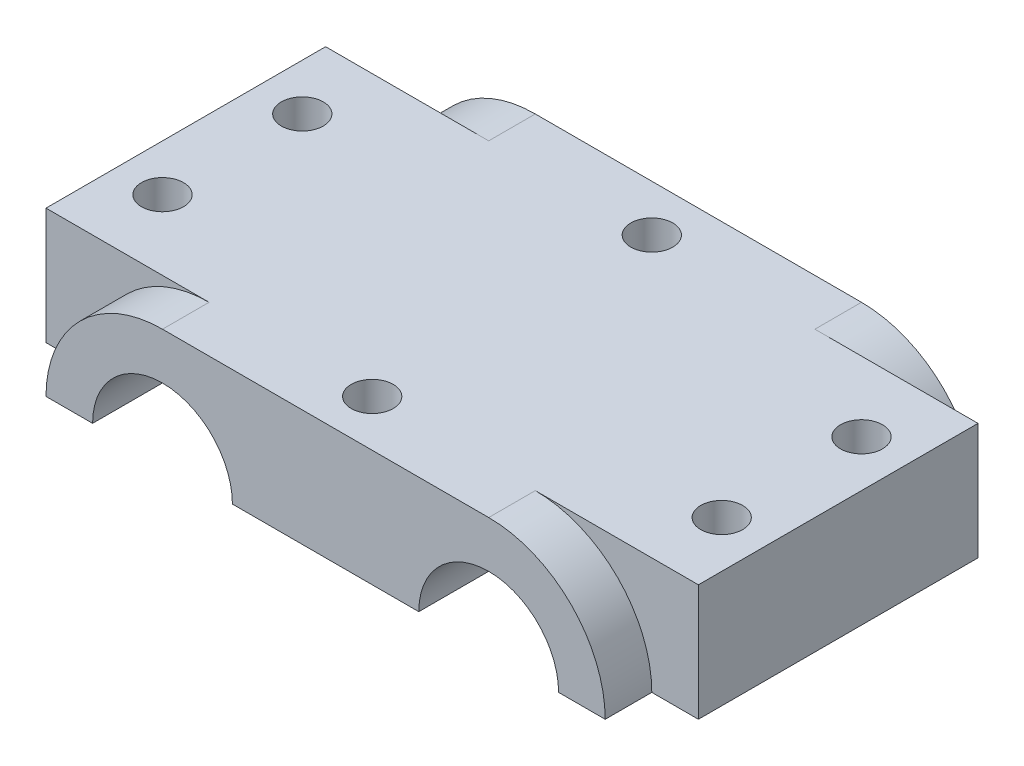
from build123d import *

# Parameters (mm, degrees)
BOSS_EXTRUDE3_DEPTH   = 5
BOSS_EXTRUDE4_START   = -30
BOSS_EXTRUDE4_DEPTH   = 30
F_1_0MM_DOWEL_HOLE1_D = 4.5
F_1_0MM_DOWEL_HOLE2_D = 4.5


with BuildPart() as part:
    # Sketch1 → Boss-Extrude3 (new body)
    with BuildSketch(Plane.XY):
        with BuildLine():
            ThreePointArc((-17.5, 6.25), (-26.338834765, 2.588834765), (-30, -6.25))
            Line((-30, -6.25), (-25, -6.25))
            ThreePointArc((-25, -6.25), (-17.5, 1.25), (-10, -6.25))
            Line((-10, -6.25), (10, -6.25))
            ThreePointArc((10, -6.25), (17.5, 1.25), (25, -6.25))
            Line((25, -6.25), (30, -6.25))
            ThreePointArc((30, -6.25), (26.338834765, 2.588834765), (17.5, 6.25))
            Line((17.5, 6.25), (-17.5, 6.25))
        make_face()
    extrude(amount=BOSS_EXTRUDE3_DEPTH)

    # Sketch1<5> → Boss-Extrude4 (add)
    with BuildSketch(Plane.XY.offset(BOSS_EXTRUDE4_START)):
        with BuildLine():
            Line((-35, 6.25), (-35, -6.25))
            Line((-35, -6.25), (-30, -6.25))
            ThreePointArc((-30, -6.25), (-26.338834765, 2.588834765), (-17.5, 6.25))
            Line((-17.5, 6.25), (-35, 6.25))
        make_face()
        with BuildLine():
            ThreePointArc((-17.5, 6.25), (-26.338834765, 2.588834765), (-30, -6.25))
            Line((-30, -6.25), (-25, -6.25))
            ThreePointArc((-25, -6.25), (-17.5, 1.25), (-10, -6.25))
            Line((-10, -6.25), (10, -6.25))
            ThreePointArc((10, -6.25), (17.5, 1.25), (25, -6.25))
            Line((25, -6.25), (30, -6.25))
            ThreePointArc((30, -6.25), (26.338834765, 2.588834765), (17.5, 6.25))
            Line((17.5, 6.25), (-17.5, 6.25))
        make_face()
        with BuildLine():
            Line((35, 6.25), (17.5, 6.25))
            ThreePointArc((17.5, 6.25), (26.338834765, 2.588834765), (30, -6.25))
            Line((30, -6.25), (35, -6.25))
            Line((35, -6.25), (35, 6.25))
        make_face()
    extrude(amount=BOSS_EXTRUDE4_DEPTH)

    # Mirror2: part across plane


with BuildPart() as part_1:
    add(part.part)
    add(part.part.mirror(Plane.XY.offset(-15)))

    # Ø1.0mm Dowel Hole1 (through all)
    with Locations(Plane(origin=(0, 6.25, -30), x_dir=(0, 0, 1), z_dir=(0, 1, 0))):
        with Locations((0, 0), (7.5, 30), (22.5, 30), (22.5, -30), (7.5, -30)):
            Hole(F_1_0MM_DOWEL_HOLE1_D / 2)

    # Ø1.0mm Dowel Hole2 (through all)
    with Locations(Plane.ZX.offset(6.25)):
        with Locations((0, 0)):
            Hole(F_1_0MM_DOWEL_HOLE2_D / 2)


solid = part_1.part
